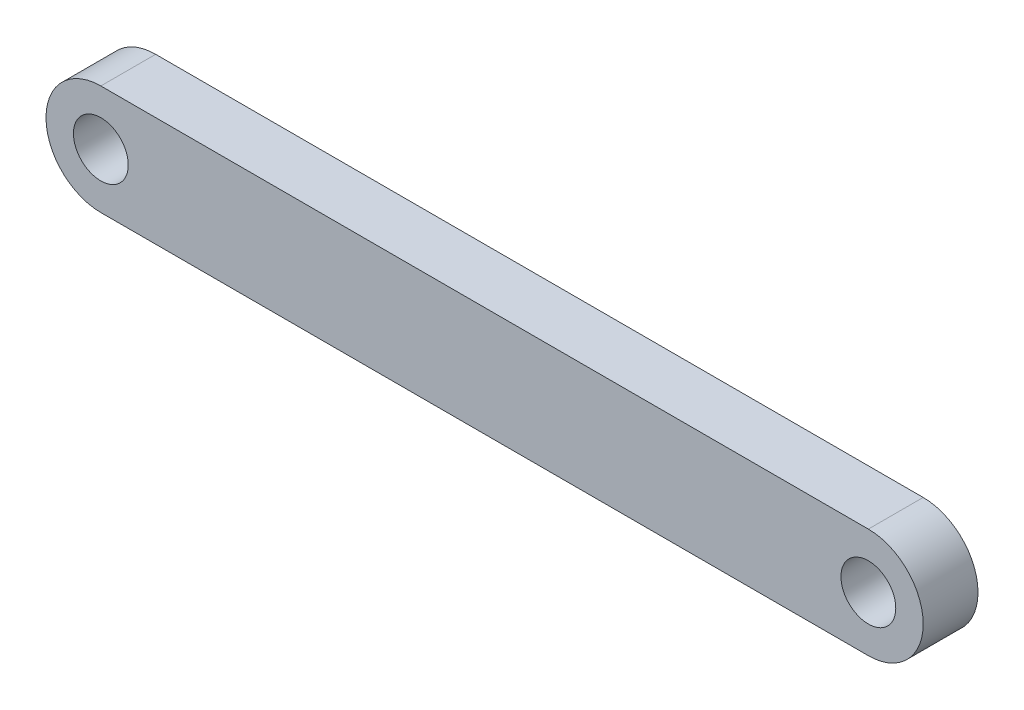
from build123d import *

# Parameters (mm, degrees)
EXTRUDE_1_DEPTH     = 2.5
SKETCH_3_R          = 2.5
CUT_EXTRUDE_2_DEPTH = 8
SKETCH_5_R          = 2.5
CUT_EXTRUDE_4_DEPTH = 8


with BuildPart() as part:
    # 草图1 → 凸台-拉伸1 (new, symmetric)
    with BuildSketch(Plane.XY):
        with BuildLine():
            Line((-69.221317243, 27.986194726), (0.778682757, 27.986194726))
            ThreePointArc((0.778682757, 27.986194726), (5.778682757, 22.986194726), (0.778682757, 17.986194726))
            Line((0.778682757, 17.986194726), (-69.221317243, 17.986194726))
            ThreePointArc((-69.221317243, 17.986194726), (-74.221317243, 22.986194726), (-69.221317243, 27.986194726))
        make_face()
    extrude(amount=EXTRUDE_1_DEPTH, both=True)

    # 草图3 → 切除-拉伸2 (cut)
    with BuildSketch(Plane.XY.offset(2.5)):
        with Locations((-69.221317243, 22.986194726)):
            Circle(SKETCH_3_R)
    extrude(amount=-CUT_EXTRUDE_2_DEPTH, mode=Mode.SUBTRACT)

    # 草图5 → 切除-拉伸4 (cut)
    with BuildSketch(Plane.XY.offset(2.5)):
        with Locations((0.778682757, 22.986194726)):
            Circle(SKETCH_5_R)
    extrude(amount=-CUT_EXTRUDE_4_DEPTH, mode=Mode.SUBTRACT)


solid = part.part
